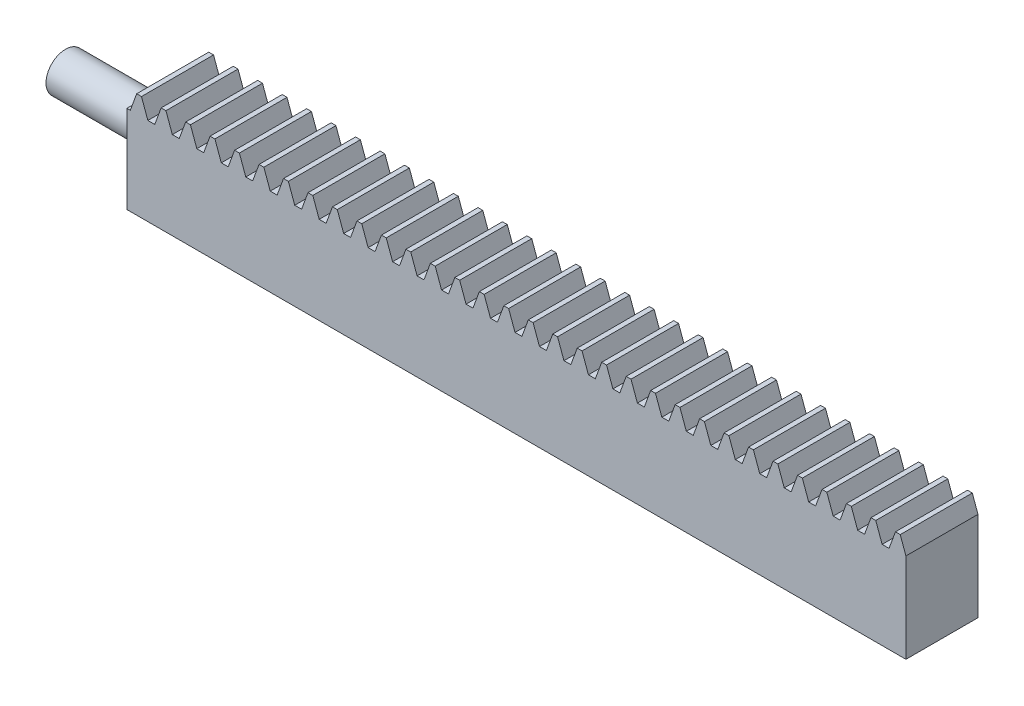
from build123d import *

# Parameters (mm, degrees)
BLANKSKE_W        = 80
BLANKSKE_H        = 10.8
BLANK_DEPTH       = 7.4
TOOTHCUTSIM_DEPTH = 82.064172111
TEETHCUTS_COUNT   = 33
TEETHCUTS_PITCH   = 2.51327412
SKETCH_1_R        = 2
EXTRUDE_1_DEPTH   = 10


with BuildPart() as part:
    # BlankSke → Blank (new body)
    with BuildSketch(Plane.XY):
        with Locations((40, 5.4)):
            Rectangle(BLANKSKE_W, BLANKSKE_H)
    extrude(amount=-BLANK_DEPTH)

    # TooCutSkeSim → ToothCutSim (cut, through all)
    with BuildSketch(Plane.XY):
        Polygon((0.354348296, 9), (-0.354348296, 9), (-1.018739561, 10.8254), (1.018739561, 10.8254), align=None)
    toothcutsim = extrude(amount=-TOOTHCUTSIM_DEPTH, mode=Mode.SUBTRACT)

    # TeethCuts: ToothCutSim ×33
    with Locations(*[(i * TEETHCUTS_PITCH, 0, 0) for i in range(1, TEETHCUTS_COUNT)]):
        add(toothcutsim, mode=Mode.SUBTRACT)

    # 草图1 → 凸台-拉伸1 (add)
    with BuildSketch(Plane.ZY):
        with Locations((-3.7, 5.4)):
            Circle(SKETCH_1_R)
    extrude(amount=EXTRUDE_1_DEPTH)


solid = part.part
